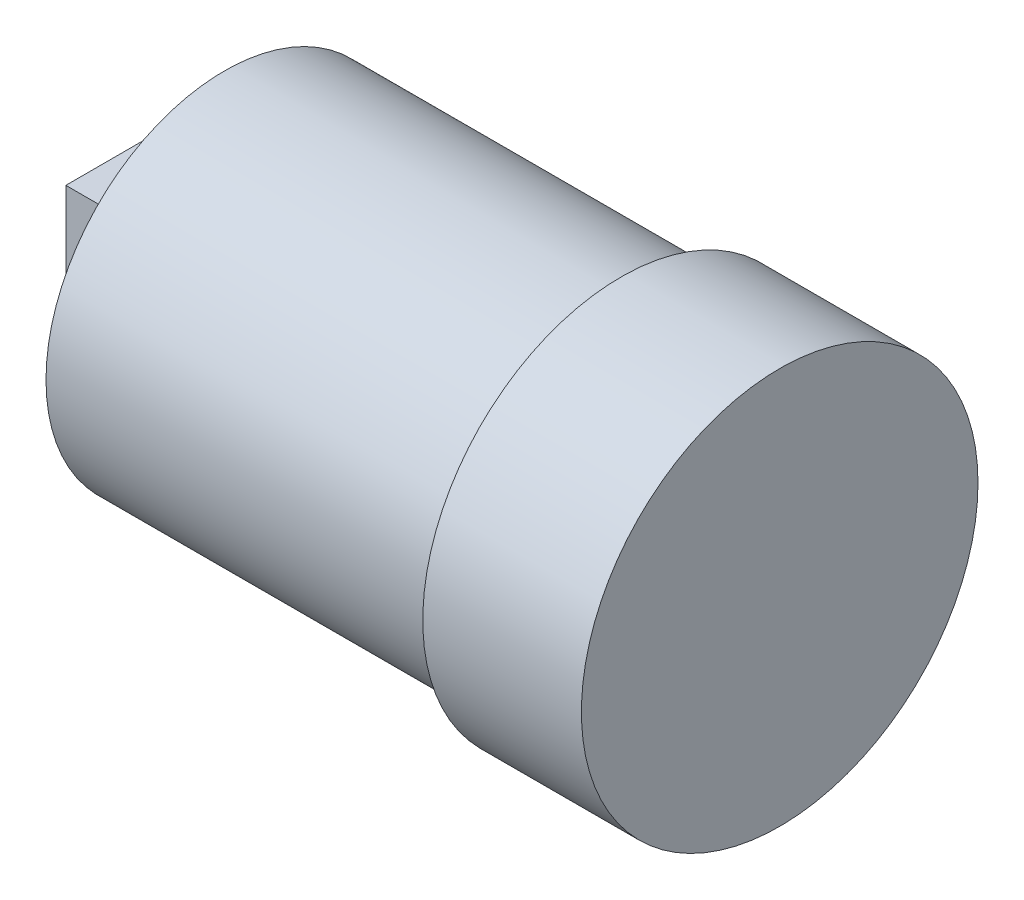
from build123d import *

# Parameters (mm, degrees)
SKETCH_1_R      = 25
EXTRUDE_1_DEPTH = 20
SKETCH_2_W      = 20
SKETCH_2_H      = 20
EXTRUDE_2_DEPTH = 60
SKETCH_3_R      = 22.5
EXTRUDE_3_DEPTH = 50


with BuildPart() as part:
    # 草图1 → 凸台-拉伸1 (new body)
    with BuildSketch(Plane(origin=(0, 0, 0), x_dir=(0, 0, -1), z_dir=(1, 0, 0))):
        Circle(SKETCH_1_R)
    extrude(amount=EXTRUDE_1_DEPTH)

    # 草图2 → 凸台-拉伸2 (add)
    with BuildSketch(Plane.ZY):
        Rectangle(SKETCH_2_W, SKETCH_2_H)
    extrude(amount=EXTRUDE_2_DEPTH)

    # 草图3 → 凸台-拉伸3 (add)
    with BuildSketch(Plane.ZY):
        with Locations(Location((0, 0, 0), (0, 0, 180))):
            Circle(SKETCH_3_R)
    extrude(amount=EXTRUDE_3_DEPTH)


solid = part.part
